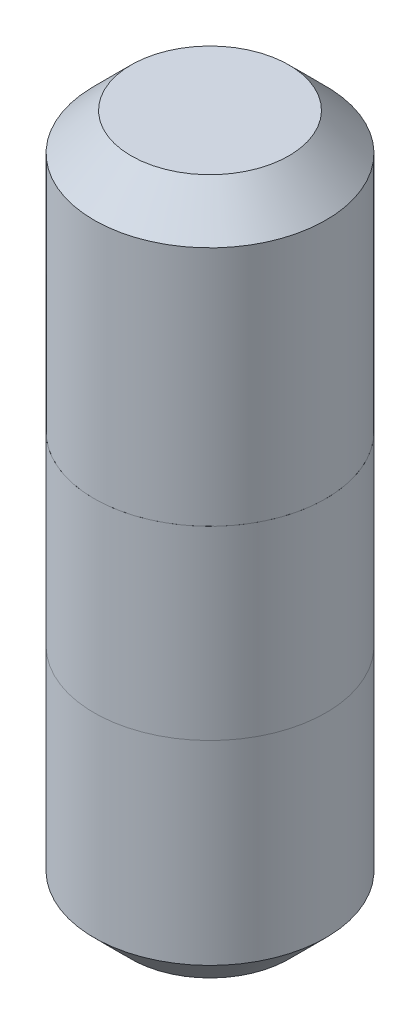
from build123d import *

# Parameters (mm, degrees)
SKETCH_1_R      = 5
EXTRUDE_1_DEPTH = 12
SKETCH_2_R      = 5
EXTRUDE_2_DEPTH = 8
EXTRUDE_START   = 10
SKETCH_3_R      = 5
EXTRUDE_3_DEPTH = 10
CHAMFER_2_SIZE  = 1.6
CHAMFER_3_SIZE  = 1.6


with BuildPart() as part:
    # Эскиз1 → Бобышка-Вытянуть1 (new body)
    with BuildSketch(Plane(origin=(0, 0, 0), x_dir=(1, 0, 0), z_dir=(0, 1, 0))):
        with Locations(Location((0, 0, 0), (0, 0, 270))):
            Circle(SKETCH_1_R)
    extrude(amount=EXTRUDE_1_DEPTH)

    # Фаска2
    chamfer_2_edges = [part.edges().sort_by_distance(p)[0] for p in [
        (0, 12, -5),
    ]]
    chamfer(chamfer_2_edges, length=CHAMFER_2_SIZE)


with BuildPart() as body_2:
    # Эскиз2 → Бобышка-Вытянуть2 (new body)
    with BuildSketch(Plane.XZ):
        with Locations(Location((0, 0, 0), (0, 0, 270))):
            Circle(SKETCH_2_R)
    extrude(amount=EXTRUDE_2_DEPTH)


with BuildPart() as body_3:
    # Эскиз3 → Бобышка-Вытянуть3 (new body)
    with BuildSketch(Plane.XZ.offset(8).offset(EXTRUDE_START)):
        with Locations(Location((0, 0, 0), (0, 0, 270))):
            Circle(SKETCH_3_R)
    extrude(amount=-EXTRUDE_3_DEPTH)

    # Фаска3
    chamfer_3_edges = [body_3.edges().sort_by_distance(p)[0] for p in [
        (0, -18, 5),
    ]]
    chamfer(chamfer_3_edges, length=CHAMFER_3_SIZE)


solid = Compound([part.part, body_2.part, body_3.part])
